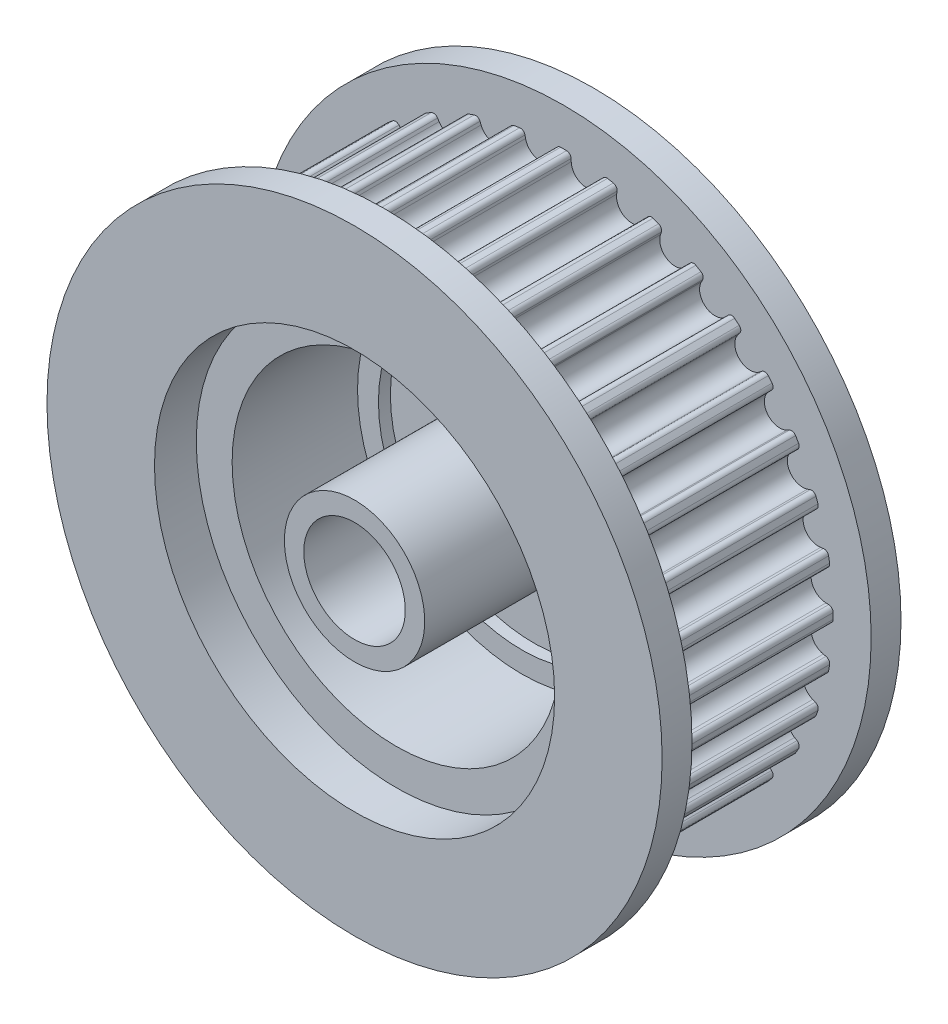
from build123d import *

# Parameters (mm, degrees)
SKETCH2_R         = 45.15
EXTRUDE1_DEPTH    = 15
EXTRUDE2_DEPTH    = 71.54817503
CIRPATTERN1_COUNT = 36
SKETCH3_R         = 51.5
EXTRUDE3_DEPTH    = 5
EXTRUDE4_START    = 5
SKETCH4_R         = 51.5
EXTRUDE4_DEPTH    = 5
SKETCH6_W         = 8.5
SKETCH6_H         = 40


with BuildPart() as part:
    # Sketch2 → Extrude1 (new, symmetric)
    with BuildSketch(Plane.XY):
        Circle(SKETCH2_R)
    extrude(amount=EXTRUDE1_DEPTH, both=True)

    # Sketch1 → Extrude2 (cut, through all)
    with BuildSketch(Plane.XY.offset(15)):
        with BuildLine():
            Line((-1.265610805, 44.394558923), (-1.282106289, 43.922190055))
            ThreePointArc((-1.282106289, 43.922190055), (-3.626550456, 41.451661388), (-6.364380048, 43.477548716))
            Line((-6.364380048, 43.477548716), (-6.462650922, 43.939876828))
            ThreePointArc((-6.462650922, 43.939876828), (-6.785899963, 44.421956093), (-7.352628199, 44.547293504))
            ThreePointArc((-7.352628199, 44.547293504), (-3.935081785, 44.978190619), (-0.494631081, 45.147290507))
            ThreePointArc((-0.494631081, 45.147290507), (-1.030984829, 44.925445927), (-1.265610805, 44.394558923))
        make_face()
    extrude2 = extrude(amount=-EXTRUDE2_DEPTH, mode=Mode.SUBTRACT)

    # CirPattern1: Extrude2 ×36 about axis
    cirpattern1_axis = Axis((0, 0, 0), (0, 0, 1))
    for i in range(1, CIRPATTERN1_COUNT):
        add(extrude2.rotate(cirpattern1_axis, i * 360 / CIRPATTERN1_COUNT), mode=Mode.SUBTRACT)

    # Sketch3 → Extrude3 (add)
    with BuildSketch(Plane(origin=(0, 0, -15), x_dir=(-1, 0, 0), z_dir=(0, 0, -1))):
        Circle(SKETCH3_R)
    extrude(amount=EXTRUDE3_DEPTH)

    # Sketch4 → Extrude4 (add)
    with BuildSketch(Plane.XY.offset(15).offset(EXTRUDE4_START)):
        with Locations(Location((0, 0, 0), (0, 0, 180))):
            Circle(SKETCH4_R)
    extrude(amount=-EXTRUDE4_DEPTH)

    # Sketch6 → Cut-Revolve1 (revolve, cut)
    with BuildSketch(Plane(origin=(0, 0, 0), x_dir=(1, 0, 0), z_dir=(0, 1, 0)), mode=Mode.PRIVATE) as cut_revolve1_sk:
        with Locations((4.25, 0)):
            Rectangle(SKETCH6_W, SKETCH6_H)
        Polygon((11.75, -20), (33.5, -20), (33.5, -13), (27.5, -13), (27.5, 8), (24, 8), (24, 10), (11.75, 10), align=None)
    revolve(cut_revolve1_sk.sketch.rotate(Axis((0, 0, -20), (0, 0, 1)), 180), axis=Axis((0, 0, -20), (0, 0, 1)), mode=Mode.SUBTRACT)


solid = part.part
